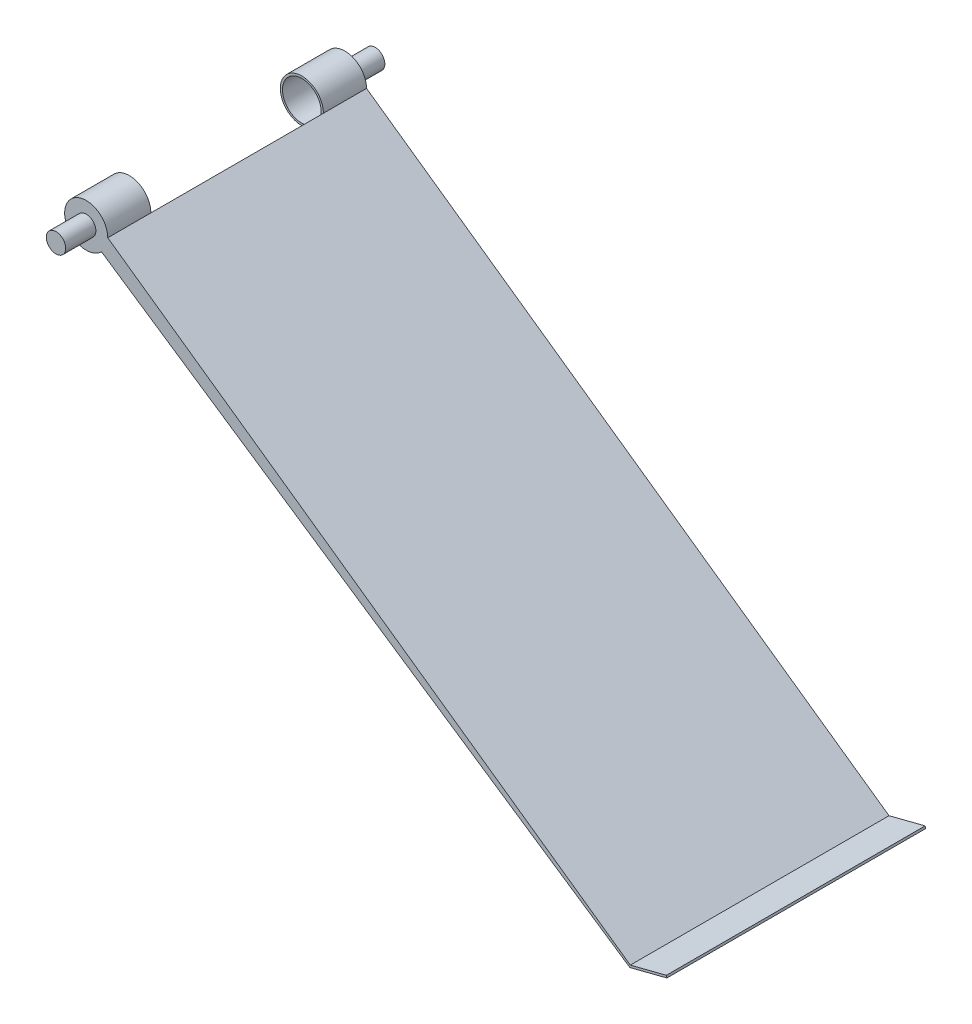
from build123d import *

# Parameters (mm, degrees)
SKETCH1_R           = 0.5
BOSS_EXTRUDE1_DEPTH = 1
SKETCH2_R           = 0.45
CUT_EXTRUDE1_DEPTH  = 0.9
SKETCH3_R           = 0.225
BOSS_EXTRUDE2_DEPTH = 0.7
BOSS_EXTRUDE3_DEPTH = 6


with BuildPart() as part:
    # Sketch1 → Boss-Extrude1 (new body)
    with BuildSketch(Plane.XY):
        Circle(SKETCH1_R)
    boss_extrude1 = extrude(amount=-BOSS_EXTRUDE1_DEPTH)

    # Sketch2 → Cut-Extrude1 (cut)
    with BuildSketch(Plane(origin=(0, 0, -1), x_dir=(-1, 0, 0), z_dir=(0, 0, -1))):
        Circle(SKETCH2_R)
    cut_extrude1 = extrude(amount=-CUT_EXTRUDE1_DEPTH, mode=Mode.SUBTRACT)

    # Sketch3 → Boss-Extrude2 (add)
    with BuildSketch(Plane.XY):
        Circle(SKETCH3_R)
    boss_extrude2 = extrude(amount=BOSS_EXTRUDE2_DEPTH)

    # Sketch4 → Boss-Extrude3 (add)
    with BuildSketch(Plane.XY):
        with BuildLine():
            Line((12.615455291, -8.546775908), (0.5, 0))
            ThreePointArc((0.5, 0), (0.461939766, -0.191341716), (0.353553391, -0.353553391))
            Line((0.353553391, -0.353553391), (12.606131889, -8.600771882))
            Line((12.606131889, -8.600771882), (13.464797628, -8.38108067))
            Line((13.464797628, -8.38108067), (13.452404243, -8.332640975))
            Line((13.452404243, -8.332640975), (12.615455291, -8.546775908))
        make_face()
    extrude(amount=-BOSS_EXTRUDE3_DEPTH)

    # Mirror1: Boss-Extrude1, Cut-Extrude1, Boss-Extrude2 across plane
    add(boss_extrude1.mirror(Plane.XY.offset(-3)))
    add(cut_extrude1.mirror(Plane.XY.offset(-3)), mode=Mode.SUBTRACT)
    add(boss_extrude2.mirror(Plane.XY.offset(-3)))


solid = part.part
